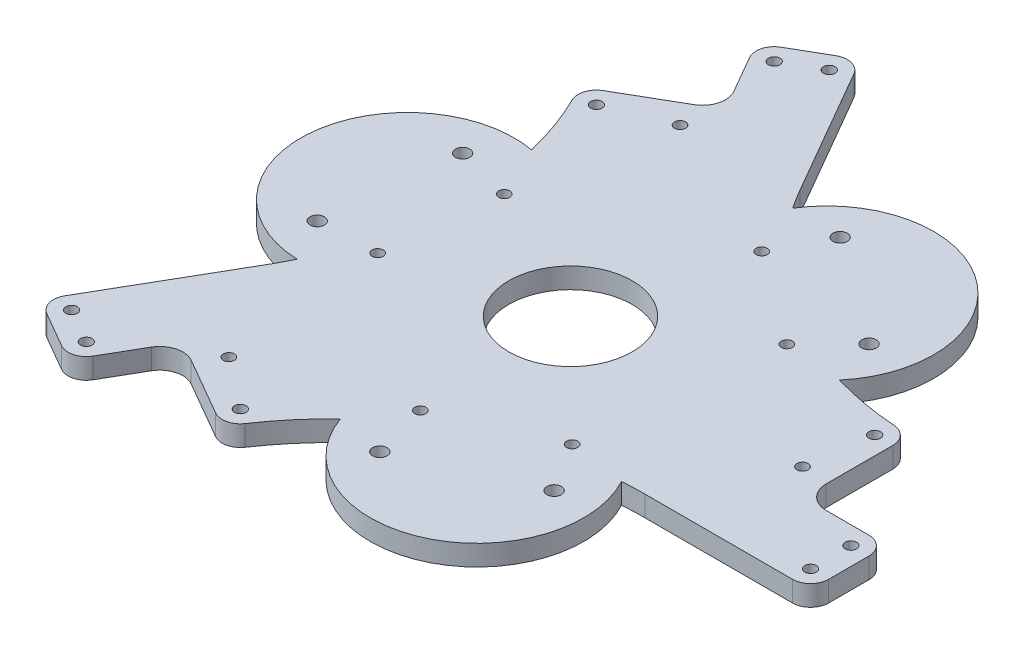
from build123d import *

# Parameters (mm, degrees)
SKETCH1_R                   = 41
BOSS_EXTRUDE1_DEPTH         = 50
FILLET2_R                   = 2
SKETCH3_R                   = 8.75
LOVIT_D17_5_THRU_DEPTH      = 623.015124039
SKETCH4_R                   = 12
LOBAC_D24X5_DEPTH           = 5
SKETCH5_R                   = 7
LOCHOT_D14_THRU_DEPTH       = 623.015124039
PATTERN_LOVIT_X3_COUNT      = 3
SKETCH6_R                   = 10
LOBAC_D20X5_DEPTH           = 5
PATTERN_LOBAC14_X3_COUNT    = 3
BOSS_EXTRUDE2_DEPTH         = 225
MATTREOVAU_D25_START        = -175
MATTREOVAU_D25_DEPTH        = 25
MATTREOVAU_GUSSET6_START    = -175
MATTREOVAU_GUSSET6_DEPTH    = 25
MATTREOVAU_GUSSET6_2_DEPTH  = 25
MATTREOVAU_GUSSET6_3_DEPTH  = 25
MATTREOVAU_GUSSET6_4_DEPTH  = 25
MATTREOVAU_GUSSET6_5_DEPTH  = 25
MATTREOTRON_X2_START        = -175
SKETCH10_R                  = 129.92
MATTREOTRON_X2_DEPTH        = 25
MATTREOTRON_X2_2_DEPTH      = 25
SK_TOOLCATKHUNG_W           = 940
SK_TOOLCATKHUNG_H           = 940
TOOL_CATCHANKHUNG_DEPTH     = 50
LOBAT_M16_X9_START          = -175
SK_LOVAU9_R                 = 7
LOBAT_M16_X9_DEPTH          = 25
LOGIUA_D150_START           = -175
SK_LOGIUA_R                 = 75
LOGIUA_D150_DEPTH           = 25
LOVIT_M20_X6_START          = -175
SKETCH12_R                  = 8.75
LOVIT_M20_X6_DEPTH          = 25
PADVIT_M12_X6_START         = -150
PADVIT_M12_X6_DEPTH         = 25
PADVIT_M12_X6_2_DEPTH       = 25
PADVIT_M12_X6_3_DEPTH       = 25
PADVIT_M12_X6_4_DEPTH       = 25
PADVIT_M12_X6_5_DEPTH       = 25
PADVIT_M12_X6_6_DEPTH       = 25
LOBU_M12_THRU_X6_START      = -175
SK_LOBU_M12_R               = 6.75
LOBU_M12_THRU_X6_DEPTH      = 25
LOBU_M12_CBORE_X6_START     = -187
SK_CBORE_M12_R              = 10
LOBU_M12_CBORE_X6_DEPTH     = 13
LOREN_M12_PAD_X6_START      = -175
SK_REN_M12_R                = 5.1
LOREN_M12_PAD_X6_DEPTH      = 20
BOSS_PADGOC_X3_START        = -175
SKETCH13_R                  = 32
BOSS_PADGOC_X3_DEPTH        = 25
BOSS_PADGOC_X3_2_DEPTH      = 25
BOSS_PADGOC_X3_3_DEPTH      = 25
LOBU_M12_THRU_GOC_X3_START  = -175
SKETCH14_R                  = 6.75
LOBU_M12_THRU_GOC_X3_DEPTH  = 12
LOBU_M12_CBORE_GOC_X3_START = -187
SKETCH15_R                  = 10
LOBU_M12_CBORE_GOC_X3_DEPTH = 13
LOREN_M12_GOC_X3_START      = -175
SKETCH16_R                  = 5.1
LOREN_M12_GOC_X3_DEPTH      = 20


with BuildPart() as part:
    # Sketch1 → Boss-Extrude1 (new body)
    with BuildSketch(Plane(origin=(0, 0, 0), x_dir=(1, 0, 0), z_dir=(0, 1, 0))):
        with BuildLine():
            Line((8.371578903, 273.5), (-81.292341855, 428.802466359))
            ThreePointArc((-81.292341855, 428.802466359), (-95.865294463, 439.98468619), (-114.076951546, 437.58707605))
            Line((-114.076951546, 437.58707605), (-156.512196331, 413.08707605))
            ThreePointArc((-156.512196331, 413.08707605), (-167.694416162, 398.514123442), (-165.296806022, 380.302466359))
            Line((-165.296806022, 380.302466359), (-139.296806022, 335.269145362))
            ThreePointArc((-139.296806022, 335.269145362), (-136.699395037, 315.53985019), (-148.813466521, 299.752484864))
            Line((-148.813466521, 299.752484864), (-218.954486267, 259.256548232))
            ThreePointArc((-218.954486267, 259.256548232), (-229.90514131, 245.491014911), (-228.527519154, 227.955082924))
            ThreePointArc((-228.527519154, 227.955082924), (-190.232761583, 47.667531746), (-241.043737387, -129.5))
            Line((-241.043737387, -129.5), (-330.707658145, -284.802466359))
            ThreePointArc((-330.707658145, -284.802466359), (-333.105268285, -303.014123442), (-321.923048454, -317.58707605))
            Line((-321.923048454, -317.58707605), (-279.487803669, -342.08707605))
            ThreePointArc((-279.487803669, -342.08707605), (-261.276146586, -344.48468619), (-246.703193978, -333.302466359))
            Line((-246.703193978, -333.302466359), (-220.703193978, -288.269145362))
            ThreePointArc((-220.703193978, -288.269145362), (-204.915828652, -276.155073879), (-185.186533479, -278.752484864))
            Line((-185.186533479, -278.752484864), (-115.045513733, -319.248421496))
            ThreePointArc((-115.045513733, -319.248421496), (-97.648884659, -321.849200291), (-83.151133157, -311.888178513))
            ThreePointArc((-83.151133157, -311.888178513), (53.835087364, -188.580170036), (232.672158483, -144))
            Line((232.672158483, -144), (412, -144))
            ThreePointArc((412, -144), (428.970562748, -136.970562748), (436, -120))
            Line((436, -120), (436, -71))
            ThreePointArc((436, -71), (428.970562748, -54.029437252), (412, -47))
            Line((412, -47), (360, -47))
            ThreePointArc((360, -47), (341.615223689, -39.384776311), (334, -21))
            Line((334, -21), (334, 59.991873264))
            ThreePointArc((334, 59.991873264), (327.554025969, 76.35818538), (311.678652311, 83.933095589))
            ThreePointArc((311.678652311, 83.933095589), (136.397674219, 140.91263829), (8.371578903, 273.5))
        make_face()
        with Locations(Location((0, 0, 0), (0, 0, 270))):
            Circle(SKETCH1_R, mode=Mode.SUBTRACT)
    extrude(amount=BOSS_EXTRUDE1_DEPTH)

    # Fillet2
    fillet2_edges = [part.edges().sort_by_distance(p)[0] for p in [
        (341.615223689, 50, 39.384776311),
        (334, 50, -19.495936632),
        (327.554025969, 50, -76.35818538),
        (-95.865294463, 50, -439.98468619),
        (-135.294573939, 50, -425.33707605),
        (-167.694416162, 50, -398.514123442),
        (-152.296806022, 50, -357.785805861),
        (327.554025969, 0, -76.35818538),
        (334, 0, -19.495936632),
        (341.615223689, 0, 39.384776311),
        (386, 0, 47),
        (428.970562748, 0, 54.029437252),
        (436, 0, 95.5),
        (428.970562748, 0, 136.970562748),
        (322.336079242, 0, 144),
        (53.835087364, 0, 188.580170036),
        (-136.699395037, 50, -315.53985019),
        (-97.648884659, 0, 321.849200291),
        (-150.116023606, 0, 299.00045318),
        (-204.915828652, 0, 276.155073879),
        (-233.703193978, 0, 310.785805861),
        (-261.276146586, 0, 344.48468619),
        (-300.705426061, 0, 329.83707605),
        (-333.105268285, 0, 303.014123442),
        (-285.875697766, 0, 207.15123318),
        (-190.232761583, 0, -47.667531746),
        (-229.90514131, 0, -245.491014911),
        (-183.883976394, 50, -279.504516548),
        (-183.883976394, 0, -279.504516548),
        (-136.699395037, 0, -315.53985019),
        (-152.296806022, 0, -357.785805861),
        (-167.694416162, 0, -398.514123442),
        (-135.294573939, 0, -425.33707605),
        (-95.865294463, 0, -439.98468619),
        (-36.460381476, 0, -351.15123318),
        (136.397674219, 0, -140.91263829),
        (-229.90514131, 50, -245.491014911),
        (-190.232761583, 50, -47.667531746),
        (-285.875697766, 50, 207.15123318),
        (-333.105268285, 50, 303.014123442),
        (136.397674219, 50, -140.91263829),
        (-300.705426061, 50, 329.83707605),
        (-261.276146586, 50, 344.48468619),
        (-233.703193978, 50, 310.785805861),
        (-204.915828652, 50, 276.155073879),
        (-150.116023606, 50, 299.00045318),
        (-97.648884659, 50, 321.849200291),
        (53.835087364, 50, 188.580170036),
        (322.336079242, 50, 144),
        (428.970562748, 50, 136.970562748),
        (436, 50, 95.5),
        (-36.460381476, 50, -351.15123318),
        (428.970562748, 50, 54.029437252),
        (386, 50, 47),
    ]]
    fillet(fillet2_edges, radius=FILLET2_R)

    # Sketch3 → LoVit-D17.5-Thru (cut, symmetric)
    with BuildSketch(Plane(origin=(0, 0, 0), x_dir=(1, 0, 0), z_dir=(0, 1, 0))):
        with Locations(Location((223, -77, 0), (0, 0, 270))):
            Circle(SKETCH3_R)
        with Locations(Location((412, -77, 0), (0, 0, 270))):
            Circle(SKETCH3_R)
        with Locations(Location((303, 25.5, 0), (0, 0, 270))):
            Circle(SKETCH3_R)
        with Locations(Location((223, 25.5, 0), (0, 0, 270))):
            Circle(SKETCH3_R)
    lovit_d17_5_thru = extrude(amount=LOVIT_D17_5_THRU_DEPTH, both=True, mode=Mode.SUBTRACT)

    # Sketch4 → LoBac-D24x5 (cut)
    with BuildSketch(Plane(origin=(0, 0, 0), x_dir=(1, 0, 0), z_dir=(0, 1, 0))):
        with Locations(Location((223, -77, 0), (0, 0, 270))):
            Circle(SKETCH4_R)
        with Locations(Location((412, -77, 0), (0, 0, 270))):
            Circle(SKETCH4_R)
        with Locations(Location((303, 25.5, 0), (0, 0, 270))):
            Circle(SKETCH4_R)
        with Locations(Location((223, 25.5, 0), (0, 0, 270))):
            Circle(SKETCH4_R)
    lobac_d24x5 = extrude(amount=LOBAC_D24X5_DEPTH, mode=Mode.SUBTRACT)

    # Sketch5 → LoChot-D14-Thru (cut, symmetric)
    with BuildSketch(Plane(origin=(0, 0, 0), x_dir=(1, 0, 0), z_dir=(0, 1, 0))):
        with Locations(Location((305, -77, 0), (0, 0, 270))):
            Circle(SKETCH5_R)
        with Locations(Location((330, -77, 0), (0, 0, 270))):
            Circle(SKETCH5_R)
    lochot_d14_thru = extrude(amount=LOCHOT_D14_THRU_DEPTH, both=True, mode=Mode.SUBTRACT)

    # Pattern-LoVit-x3: LoVit-D17.5-Thru, LoBac-D24x5, LoChot-D14-Thru ×3 about axis
    pattern_lovit_x3_axis = Axis((0, 0, 0), (0, 1, 0))
    add([lovit_d17_5_thru.rotate(pattern_lovit_x3_axis, i * 360 / PATTERN_LOVIT_X3_COUNT) for i in range(1, PATTERN_LOVIT_X3_COUNT)], mode=Mode.SUBTRACT)
    add([lobac_d24x5.rotate(pattern_lovit_x3_axis, i * 360 / PATTERN_LOVIT_X3_COUNT) for i in range(1, PATTERN_LOVIT_X3_COUNT)], mode=Mode.SUBTRACT)
    add([lochot_d14_thru.rotate(pattern_lovit_x3_axis, i * 360 / PATTERN_LOVIT_X3_COUNT) for i in range(1, PATTERN_LOVIT_X3_COUNT)], mode=Mode.SUBTRACT)

    # Sketch6 → LoBac-D20x5 (cut)
    with BuildSketch(Plane(origin=(0, 0, 0), x_dir=(1, 0, 0), z_dir=(0, 1, 0))):
        with Locations(Location((305, -77, 0), (0, 0, 270))):
            Circle(SKETCH6_R)
        with Locations(Location((330, -77, 0), (0, 0, 270))):
            Circle(SKETCH6_R)
    lobac_d20x5 = extrude(amount=LOBAC_D20X5_DEPTH, mode=Mode.SUBTRACT)

    # Pattern-LoBac14-x3: LoBac-D20x5 ×3 about axis
    pattern_lobac14_x3_axis = Axis((0, 0, 0), (0, 1, 0))
    for i in range(1, PATTERN_LOBAC14_X3_COUNT):
        add(lobac_d20x5.rotate(pattern_lobac14_x3_axis, i * 360 / PATTERN_LOBAC14_X3_COUNT), mode=Mode.SUBTRACT)


with BuildPart() as body_2:
    # Sketch7 → Boss-Extrude2 (new body)
    with BuildSketch(Plane(origin=(0, 50, 0), x_dir=(1, 0, 0), z_dir=(0, 1, 0))):
        with BuildLine():
            Line((-184.186533479, -277.020434056), (-114.045513733, -317.516370688))
            ThreePointArc((-114.045513733, -317.516370688), (-98.098603748, -319.900417917), (-84.808998205, -310.769481287))
            ThreePointArc((-84.808998205, -310.769481287), (52.896310087, -186.814186676), (232.672158483, -142))
            Line((232.672158483, -142), (412, -142))
            ThreePointArc((412, -142), (427.556349186, -135.556349186), (434, -120))
            Line((434, -120), (434, -71))
            ThreePointArc((434, -71), (427.556349186, -55.443650814), (412, -49))
            Line((412, -49), (360, -49))
            ThreePointArc((360, -49), (340.201010127, -40.798989873), (332, -21))
            Line((332, -21), (332, 59.991873264))
            ThreePointArc((332, 59.991873264), (326.091190472, 74.994326037), (311.538764618, 81.937993729))
            ThreePointArc((311.538764618, 81.937993729), (135.337676405, 139.21664164), (6.639528096, 272.5))
            Line((6.639528096, 272.5), (-83.024392663, 427.802466359))
            ThreePointArc((-83.024392663, 427.802466359), (-96.382932554, 438.052834538), (-113.076951546, 435.855025242))
            Line((-113.076951546, 435.855025242), (-155.512196331, 411.355025242))
            ThreePointArc((-155.512196331, 411.355025242), (-165.76256451, 397.996485351), (-163.564755215, 381.302466359))
            Line((-163.564755215, 381.302466359), (-137.564755215, 336.269145362))
            ThreePointArc((-137.564755215, 336.269145362), (-134.767543384, 315.0222121), (-147.813466521, 298.020434056))
            Line((-147.813466521, 298.020434056), (-217.954486267, 257.524497424))
            ThreePointArc((-217.954486267, 257.524497424), (-227.992586724, 244.90609188), (-226.729766413, 228.831487559))
            ThreePointArc((-226.729766413, 228.831487559), (-188.233986493, 47.597545036), (-239.311686579, -130.5))
            Line((-239.311686579, -130.5), (-328.975607337, -285.802466359))
            ThreePointArc((-328.975607337, -285.802466359), (-331.173416632, -302.496485351), (-320.923048454, -315.855025242))
            Line((-320.923048454, -315.855025242), (-278.487803669, -340.355025242))
            ThreePointArc((-278.487803669, -340.355025242), (-261.793784676, -342.552834538), (-248.435244785, -332.302466359))
            Line((-248.435244785, -332.302466359), (-222.435244785, -287.269145362))
            ThreePointArc((-222.435244785, -287.269145362), (-205.433466742, -274.223222226), (-184.186533479, -277.020434056))
        make_face()
        with BuildLine():
            Line((-180.186533479, -270.092230826), (-110.045513733, -310.588167458))
            ThreePointArc((-110.045513733, -310.588167458), (-99.897480106, -312.105288422), (-91.440458397, -306.294692385))
            ThreePointArc((-91.440458397, -306.294692385), (49.141200982, -179.750253239), (232.672158483, -134))
            Line((232.672158483, -134), (412, -134))
            ThreePointArc((412, -134), (421.899494937, -129.899494937), (426, -120))
            Line((426, -120), (426, -71))
            ThreePointArc((426, -71), (421.899494937, -61.100505063), (412, -57))
            Line((412, -57), (360, -57))
            ThreePointArc((360, -57), (334.544155877, -46.455844123), (324, -21))
            Line((324, -21), (324, 59.991873264))
            ThreePointArc((324, 59.991873264), (320.239848482, 69.538888665), (310.979213848, 73.957586287))
            ThreePointArc((310.979213848, 73.957586287), (131.09768515, 132.432655043), (-0.288675135, 268.5))
            Line((-0.288675135, 268.5), (-89.952595893, 423.802466359))
            ThreePointArc((-89.952595893, 423.802466359), (-98.453484914, 430.325427927), (-109.076951546, 428.926822012))
            Line((-109.076951546, 428.926822012), (-151.512196331, 404.426822012))
            ThreePointArc((-151.512196331, 404.426822012), (-158.035157899, 395.925932991), (-156.636551984, 385.302466359))
            Line((-156.636551984, 385.302466359), (-130.636551984, 340.269145362))
            ThreePointArc((-130.636551984, 340.269145362), (-127.040136774, 312.951659739), (-143.813466521, 291.092230826))
            Line((-143.813466521, 291.092230826), (-213.954486267, 250.596294194))
            ThreePointArc((-213.954486267, 250.596294194), (-220.342368376, 242.566399757), (-219.538755451, 232.337106098))
            ThreePointArc((-219.538755451, 232.337106098), (-180.238886133, 47.317598196), (-232.383483349, -134.5))
            Line((-232.383483349, -134.5), (-322.047404107, -289.802466359))
            ThreePointArc((-322.047404107, -289.802466359), (-323.446010022, -300.425932991), (-316.923048454, -308.926822012))
            Line((-316.923048454, -308.926822012), (-274.487803669, -333.426822012))
            ThreePointArc((-274.487803669, -333.426822012), (-263.864337037, -334.825427927), (-255.363448016, -328.302466359))
            Line((-255.363448016, -328.302466359), (-229.363448016, -283.269145362))
            ThreePointArc((-229.363448016, -283.269145362), (-207.504019103, -266.495815616), (-180.186533479, -270.092230826))
        make_face(mode=Mode.SUBTRACT)
    extrude(amount=-BOSS_EXTRUDE2_DEPTH)


with BuildPart() as body_3:
    # Sk-MatTreoVau → MatTreoVau-D25 (new body)
    with BuildSketch(Plane(origin=(0, 0, 0), x_dir=(1, 0, 0), z_dir=(0, 1, 0)).offset(MATTREOVAU_D25_START)):
        with BuildLine():
            Line((-114.045513733, -317.516370688), (-184.186533479, -277.020434056))
            ThreePointArc((-184.186533479, -277.020434056), (-205.433466742, -274.223222226), (-222.435244785, -287.269145362))
            Line((-222.435244785, -287.269145362), (-248.435244785, -332.302466359))
            ThreePointArc((-248.435244785, -332.302466359), (-261.793784676, -342.552834538), (-278.487803669, -340.355025242))
            Line((-278.487803669, -340.355025242), (-320.923048454, -315.855025242))
            ThreePointArc((-320.923048454, -315.855025242), (-331.173416632, -302.496485351), (-328.975607337, -285.802466359))
            Line((-328.975607337, -285.802466359), (-239.311686579, -130.5))
            ThreePointArc((-239.311686579, -130.5), (-218.0908365, -87.810397331), (-202.337273797, -42.815376315))
            ThreePointArc((-202.337273797, -42.815376315), (-206.139748433, -21.394031931), (-225.28696343, -11.0636415))
            ThreePointArc((-225.28696343, -11.0636415), (-258.528834053, 27.619593831), (-217.865133416, 58.407222981))
            ThreePointArc((-217.865133416, 58.407222981), (-196.967697859, 64.459494929), (-188.725649398, 84.594078256))
            ThreePointArc((-188.725649398, 84.594078256), (-200.638746521, 158.580604294), (-226.729766413, 228.831487559))
            ThreePointArc((-226.729766413, 228.831487559), (-227.992586724, 244.90609188), (-217.954486267, 257.524497424))
            Line((-217.954486267, 257.524497424), (-147.813466521, 298.020434056))
            ThreePointArc((-147.813466521, 298.020434056), (-134.767543384, 315.0222121), (-137.564755215, 336.269145362))
            Line((-137.564755215, 336.269145362), (-163.564755215, 381.302466359))
            ThreePointArc((-163.564755215, 381.302466359), (-165.76256451, 397.996485351), (-155.512196331, 411.355025242))
            Line((-155.512196331, 411.355025242), (-113.076951546, 435.855025242))
            ThreePointArc((-113.076951546, 435.855025242), (-96.382932554, 438.052834538), (-83.024392663, 427.802466359))
            Line((-83.024392663, 427.802466359), (6.639528096, 272.5))
            ThreePointArc((6.639528096, 272.5), (32.999383444, 232.777403407), (64.089433337, 196.636907398))
            ThreePointArc((64.089433337, 196.636907398), (84.542099075, 189.219274839), (103.062087117, 200.636054222))
            ThreePointArc((103.062087117, 200.636054222), (153.183686926, 210.082740985), (159.514705574, 159.473128647))
            ThreePointArc((159.514705574, 159.473128647), (154.307409053, 138.349282607), (167.623445478, 121.144167596))
            ThreePointArc((167.623445478, 121.144167596), (237.654205127, 94.467949324), (311.538764618, 81.937993729))
            ThreePointArc((311.538764618, 81.937993729), (326.091190472, 74.994326037), (332, 59.991873264))
            Line((332, 59.991873264), (332, -21))
            ThreePointArc((332, -21), (340.201010127, -40.798989873), (360, -49))
            Line((360, -49), (412, -49))
            ThreePointArc((412, -49), (427.556349186, -55.443650814), (434, -71))
            Line((434, -71), (434, -120))
            ThreePointArc((434, -120), (427.556349186, -135.556349186), (412, -142))
            Line((412, -142), (232.672158483, -142))
            ThreePointArc((232.672158483, -142), (185.091453055, -144.967006076), (138.24784046, -153.821531083))
            ThreePointArc((138.24784046, -153.821531083), (121.597649359, -167.825242907), (122.224876312, -189.572412722))
            ThreePointArc((122.224876312, -189.572412722), (105.345147127, -237.702334816), (58.350427842, -217.880351628))
            ThreePointArc((58.350427842, -217.880351628), (42.660288806, -202.808777536), (21.10220392, -205.738245852))
            ThreePointArc((21.10220392, -205.738245852), (-37.015458606, -253.048553618), (-84.808998205, -310.769481287))
            ThreePointArc((-84.808998205, -310.769481287), (-98.098603748, -319.900417917), (-114.045513733, -317.516370688))
        make_face()
    extrude(amount=-MATTREOVAU_D25_DEPTH)


with BuildPart() as body_4:
    # Sketch8 → MatTreoVau-Gusset6 (new body)
    with BuildSketch(Plane(origin=(0, 0, 0), x_dir=(1, 0, 0), z_dir=(0, 1, 0)).offset(MATTREOVAU_GUSSET6_START)):
        Polygon((-137.497159422, -74.963532139), (-156.055536108, 13.10227652), (-294.846276167, -31.474965139), (-282.474025043, -90.185504245), align=None)
    extrude(amount=-MATTREOVAU_GUSSET6_DEPTH)


with BuildPart() as body_5:
    # Sketch8 → MatTreoVau-Gusset6 2 (new body)
    with BuildSketch(Plane(origin=(0, 0, 0), x_dir=(1, 0, 0), z_dir=(0, 1, 0)).offset(MATTREOVAU_GUSSET6_START)):
        Polygon((-155.299997302, 20.172031082), (-118.550255868, 102.327107033), (-257.036168472, 147.842511129), (-281.535996095, 93.072460496), align=None)
    extrude(amount=-MATTREOVAU_GUSSET6_2_DEPTH)


with BuildPart() as body_6:
    # Sketch8 → MatTreoVau-Gusset6 3 (new body)
    with BuildSketch(Plane(origin=(0, 0, 0), x_dir=(1, 0, 0), z_dir=(0, 1, 0)).offset(MATTREOVAU_GUSSET6_START)):
        Polygon((3.828256521, 156.557799078), (89.374672368, 128.596920411), (120.16501869, 271.081847941), (63.134074792, 289.722433719), align=None)
    extrude(amount=-MATTREOVAU_GUSSET6_3_DEPTH)


with BuildPart() as body_7:
    # Sketch8 → MatTreoVau-Gusset6 4 (new body)
    with BuildSketch(Plane(origin=(0, 0, 0), x_dir=(1, 0, 0), z_dir=(0, 1, 0)).offset(MATTREOVAU_GUSSET6_START)):
        Polygon((95.119490014, 124.40772733), (147.89300212, 51.50397969), (256.553454634, 148.678596024), (221.371113229, 197.28109445), align=None)
    extrude(amount=-MATTREOVAU_GUSSET6_4_DEPTH)


with BuildPart() as body_8:
    # Sketch8 → MatTreoVau-Gusset6 5 (new body)
    with BuildSketch(Plane(origin=(0, 0, 0), x_dir=(1, 0, 0), z_dir=(0, 1, 0)).offset(MATTREOVAU_GUSSET6_START)):
        with BuildLine():
            Line((-29.342746252, -153.831086723), (133.668902901, -81.594266938))
            ThreePointArc((133.668902901, -81.594266938), (143.083176972, -322.885541111), (-29.342746252, -153.831086723))
        make_face()
    extrude(amount=-MATTREOVAU_GUSSET6_5_DEPTH)


with BuildPart() as body_9:
    # Sketch10 → MatTreoTron-x2 (new body)
    with BuildSketch(Plane(origin=(0, 0, 0), x_dir=(1, 0, 0), z_dir=(0, 1, 0)).offset(MATTREOTRON_X2_START)):
        with Locations(Location((131.555784912, 180.338696502, 0), (0, 0, 270))):
            Circle(SKETCH10_R)
    extrude(amount=-MATTREOTRON_X2_DEPTH)


with BuildPart() as body_10:
    # Sketch10 → MatTreoTron-x2 2 (new body)
    with BuildSketch(Plane(origin=(0, 0, 0), x_dir=(1, 0, 0), z_dir=(0, 1, 0)).offset(MATTREOTRON_X2_START)):
        with Locations(Location((-221.955784912, 23.761303498, 0), (0, 0, 270))):
            Circle(SKETCH10_R)
    extrude(amount=-MATTREOTRON_X2_2_DEPTH)


with BuildPart() as body_3_1:
    add(body_3.part)

    # GopKhoi-MatTreo: union body 8, body 10, body 5, body 6, body 4, body 9, body 7
    add(body_8.part)
    add(body_10.part)
    add(body_5.part)
    add(body_6.part)
    add(body_4.part)
    add(body_9.part)
    add(body_7.part)

    # Sk-LoVau9 → LoBat-M16-x9 (cut)
    with BuildSketch(Plane(origin=(0, 0, 0), x_dir=(1, 0, 0), z_dir=(0, 1, 0)).offset(LOBAT_M16_X9_START)):
        with Locations(Location((412, -71, 0), (0, 0, 270))):
            Circle(SK_LOVAU9_R)
        with Locations(Location((412, -120, 0), (0, 0, 270))):
            Circle(SK_LOVAU9_R)
        with Locations(Location((-102.077, 416.802, 0), (0, 0, 270))):
            Circle(SK_LOVAU9_R)
        with Locations(Location((-144.512, 392.302, 0), (0, 0, 270))):
            Circle(SK_LOVAU9_R)
        with Locations(Location((-267.488, -321.302, 0), (0, 0, 270))):
            Circle(SK_LOVAU9_R)
        with Locations(Location((-309.923, -296.802, 0), (0, 0, 270))):
            Circle(SK_LOVAU9_R)
        with Locations(Location((-206.954, 238.472, 0), (0, 0, 270))):
            Circle(SK_LOVAU9_R)
        with Locations(Location((310, 59.992, 0), (0, 0, 270))):
            Circle(SK_LOVAU9_R)
        with Locations(Location((-103.046, -298.464, 0), (0, 0, 270))):
            Circle(SK_LOVAU9_R)
    extrude(amount=-LOBAT_M16_X9_DEPTH, mode=Mode.SUBTRACT)

    # Sk-LoGiua → LoGiua-D150 (cut)
    with BuildSketch(Plane(origin=(0, 0, 0), x_dir=(1, 0, 0), z_dir=(0, 1, 0)).offset(LOGIUA_D150_START)):
        with Locations(Location((0, 0, 0), (0, 0, 270))):
            Circle(SK_LOGIUA_R)
    extrude(amount=-LOGIUA_D150_DEPTH, mode=Mode.SUBTRACT)

    # Sketch12 → LoVit-M20-x6 (cut)
    with BuildSketch(Plane(origin=(0, 0, 0), x_dir=(1, 0, 0), z_dir=(0, 1, 0)).offset(LOVIT_M20_X6_START)):
        with Locations(Location((173.636464422, -193.52100202, 0), (0, 0, 270))):
            Circle(SKETCH12_R)
        with Locations(Location((26.726059565, -258.62273245, 0), (0, 0, 270))):
            Circle(SKETCH12_R)
        with Locations(Location((80.775871704, 247.134090223, 0), (0, 0, 270))):
            Circle(SKETCH12_R)
        with Locations(Location((210.610826516, 152.456812751, 0), (0, 0, 270))):
            Circle(SKETCH12_R)
        with Locations(Location((-254.412336126, -53.613088203, 0), (0, 0, 270))):
            Circle(SKETCH12_R)
        with Locations(Location((-237.336886081, 106.165919699, 0), (0, 0, 270))):
            Circle(SKETCH12_R)
    extrude(amount=-LOVIT_M20_X6_DEPTH, mode=Mode.SUBTRACT)

    # Sk-LoBu-M12 → LoBu-M12-Thru-x6 (cut)
    with BuildSketch(Plane(origin=(0, 0, 0), x_dir=(1, 0, 0), z_dir=(0, 1, 0)).offset(LOBU_M12_THRU_X6_START)):
        with Locations(Location((7.886992904, -190.512930413, 0), (0, 0, 270))):
            Circle(SK_LOBU_M12_R)
        with Locations(Location((135.844382435, -133.804652657, 0), (0, 0, 270))):
            Circle(SK_LOBU_M12_R)
        with Locations(Location((161.04705128, 102.088745556, 0), (0, 0, 270))):
            Circle(SK_LOBU_M12_R)
        with Locations(Location((47.957582181, 184.54900435, 0), (0, 0, 270))):
            Circle(SK_LOBU_M12_R)
        with Locations(Location((-168.934294158, 88.425684784, 0), (0, 0, 270))):
            Circle(SK_LOBU_M12_R)
        with Locations(Location((-183.801686509, -50.742856727, 0), (0, 0, 270))):
            Circle(SK_LOBU_M12_R)
    extrude(amount=-LOBU_M12_THRU_X6_DEPTH, mode=Mode.SUBTRACT)

    # Sk-CBore-M12 → LoBu-M12-CBore-x6 (cut)
    with BuildSketch(Plane(origin=(0, 0, 0), x_dir=(1, 0, 0), z_dir=(0, 1, 0)).offset(LOBU_M12_CBORE_X6_START)):
        with Locations(Location((7.886992904, -190.512930413, 0), (0, 0, 270))):
            Circle(SK_CBORE_M12_R)
        with Locations(Location((135.844382435, -133.804652657, 0), (0, 0, 270))):
            Circle(SK_CBORE_M12_R)
        with Locations(Location((161.04705128, 102.088745556, 0), (0, 0, 270))):
            Circle(SK_CBORE_M12_R)
        with Locations(Location((47.957582181, 184.54900435, 0), (0, 0, 270))):
            Circle(SK_CBORE_M12_R)
        with Locations(Location((-168.934294158, 88.425684784, 0), (0, 0, 270))):
            Circle(SK_CBORE_M12_R)
        with Locations(Location((-183.801686509, -50.742856727, 0), (0, 0, 270))):
            Circle(SK_CBORE_M12_R)
    extrude(amount=-LOBU_M12_CBORE_X6_DEPTH, mode=Mode.SUBTRACT)

    # Sketch14 → LoBu-M12-Thru-Goc-x3 (cut)
    with BuildSketch(Plane(origin=(0, 0, 0), x_dir=(1, 0, 0), z_dir=(0, 1, 0)).offset(LOBU_M12_THRU_GOC_X3_START)):
        with Locations(Location((299.502544984, -17.269208088, 0), (0, 0, 270))):
            Circle(SKETCH14_R)
        with Locations(Location((-164.706845399, -250.74220841, 0), (0, 0, 270))):
            Circle(SKETCH14_R)
        with Locations(Location((-134.795699585, 268.011416498, 0), (0, 0, 270))):
            Circle(SKETCH14_R)
    extrude(amount=-LOBU_M12_THRU_GOC_X3_DEPTH, mode=Mode.SUBTRACT)

    # Sketch15 → LoBu-M12-CBore-Goc-x3 (cut)
    with BuildSketch(Plane(origin=(0, 0, 0), x_dir=(1, 0, 0), z_dir=(0, 1, 0)).offset(LOBU_M12_CBORE_GOC_X3_START)):
        with Locations(Location((299.502544984, -17.269208088, 0), (0, 0, 270))):
            Circle(SKETCH15_R)
        with Locations(Location((-164.706845399, -250.74220841, 0), (0, 0, 270))):
            Circle(SKETCH15_R)
        with Locations(Location((-134.795699585, 268.011416498, 0), (0, 0, 270))):
            Circle(SKETCH15_R)
    extrude(amount=-LOBU_M12_CBORE_GOC_X3_DEPTH, mode=Mode.SUBTRACT)


with BuildPart() as body_4_2:
    # Sk-ToolCatKhung → Tool-CatChanKhung (new body)
    with BuildSketch(Plane(origin=(0, 0, 0), x_dir=(1, 0, 0), z_dir=(0, 1, 0))):
        Rectangle(SK_TOOLCATKHUNG_W, SK_TOOLCATKHUNG_H)
    extrude(amount=TOOL_CATCHANKHUNG_DEPTH)


with BuildPart() as body_2_1:
    add(body_2.part)

    # CatChanKhung: cut body 4 2
    add(body_4_2.part, mode=Mode.SUBTRACT)


with BuildPart() as body_4_3:
    # Sk-PadVit-M12 → PadVit-M12-x6 (new body)
    with BuildSketch(Plane(origin=(0, 0, 0), x_dir=(1, 0, 0), z_dir=(0, 1, 0)).offset(PADVIT_M12_X6_START)):
        with BuildLine():
            Line((33.404320909, -192.077803179), (19.024323449, -168.052490006))
            ThreePointArc((19.024323449, -168.052490006), (0.635928159, -179.723024942), (-17.116477868, -192.339940068))
            Line((-17.116477868, -192.339940068), (-0.303926473, -214.730521025))
            ThreePointArc((-0.303926473, -214.730521025), (16.253606071, -202.962821341), (33.404320909, -192.077803179))
        make_face()
    extrude(amount=-PADVIT_M12_X6_DEPTH)


with BuildPart() as body_5_2:
    # Sk-PadVit-M12 → PadVit-M12-x6 2 (new body)
    with BuildSketch(Plane(origin=(0, 0, 0), x_dir=(1, 0, 0), z_dir=(0, 1, 0)).offset(PADVIT_M12_X6_START)):
        with BuildLine():
            Line((119.864532126, -153.760284428), (111.723931352, -126.96978949))
            ThreePointArc((111.723931352, -126.96978949), (132.720975416, -121.185447904), (153.99197281, -116.507933936))
            Line((153.99197281, -116.507933936), (159.287609255, -144.002592229))
            ThreePointArc((159.287609255, -144.002592229), (139.44831361, -148.365273526), (119.864532126, -153.760284428))
        make_face()
    extrude(amount=-PADVIT_M12_X6_2_DEPTH)


with BuildPart() as body_6_2:
    # Sk-PadVit-M12 → PadVit-M12-x6 3 (new body)
    with BuildSketch(Plane(origin=(0, 0, 0), x_dir=(1, 0, 0), z_dir=(0, 1, 0)).offset(PADVIT_M12_X6_START)):
        with BuildLine():
            Line((149.643616505, 124.969841041), (136.027073366, 100.503747096))
            ThreePointArc((136.027073366, 100.503747096), (155.328246483, 90.414188961), (175.131014685, 81.348603567))
            Line((175.131014685, 81.348603567), (186.115561774, 107.103986019))
            ThreePointArc((186.115561774, 107.103986019), (167.6456722, 115.559387781), (149.643616505, 124.969841041))
        make_face()
    extrude(amount=-PADVIT_M12_X6_3_DEPTH)


with BuildPart() as body_7_2:
    # Sk-PadVit-M12 → PadVit-M12-x6 4 (new body)
    with BuildSketch(Plane(origin=(0, 0, 0), x_dir=(1, 0, 0), z_dir=(0, 1, 0)).offset(PADVIT_M12_X6_START)):
        with BuildLine():
            Line((73.229589768, 180.687853253), (54.098632328, 160.242646786))
            ThreePointArc((54.098632328, 160.242646786), (38.590729993, 175.534456103), (23.904392162, 191.616929425))
            Line((23.904392162, 191.616929425), (45.067654228, 209.950405329))
            ThreePointArc((45.067654228, 209.950405329), (58.765488551, 194.950406173), (73.229589768, 180.687853253))
        make_face()
    extrude(amount=-PADVIT_M12_X6_4_DEPTH)


with BuildPart() as body_8_2:
    # Sk-PadVit-M12 → PadVit-M12-x6 5 (new body)
    with BuildSketch(Plane(origin=(0, 0, 0), x_dir=(1, 0, 0), z_dir=(0, 1, 0)).offset(PADVIT_M12_X6_START)):
        with BuildLine():
            Line((-183.048102175, 67.109416853), (-155.051573466, 67.550302605))
            ThreePointArc((-155.051573466, 67.550302605), (-155.964432679, 89.310384293), (-158.014875534, 110.992869186))
            Line((-158.014875534, 110.992869186), (-185.811951219, 107.627964529))
            ThreePointArc((-185.811951219, 107.627964529), (-183.899518941, 87.404877658), (-183.048102175, 67.109416853))
        make_face()
    extrude(amount=-PADVIT_M12_X6_5_DEPTH)


with BuildPart() as body_9_2:
    # Sk-PadVit-M12 → PadVit-M12-x6 6 (new body)
    with BuildSketch(Plane(origin=(0, 0, 0), x_dir=(1, 0, 0), z_dir=(0, 1, 0)).offset(PADVIT_M12_X6_START)):
        with BuildLine():
            Line((-193.093929834, -26.926117461), (-165.82235776, -33.271301195))
            ThreePointArc((-165.82235776, -33.271301195), (-171.311418332, -54.347465008), (-177.895997523, -75.107469437))
            Line((-177.895997523, -75.107469437), (-204.354920767, -65.946389764))
            ThreePointArc((-204.354920767, -65.946389764), (-198.213534405, -46.583693325), (-193.093929834, -26.926117461))
        make_face()
    extrude(amount=-PADVIT_M12_X6_6_DEPTH)


with BuildPart() as body_2_2:
    add(body_2_1.part)

    # GopKhung-Pad: union body 8 2, body 9 2, body 5 2, body 6 2, body 4 3, body 7 2
    add(body_8_2.part)
    add(body_9_2.part)
    add(body_5_2.part)
    add(body_6_2.part)
    add(body_4_3.part)
    add(body_7_2.part)

    # Sk-Ren-M12 → LoRen-M12-Pad-x6 (cut)
    with BuildSketch(Plane(origin=(0, 0, 0), x_dir=(1, 0, 0), z_dir=(0, 1, 0)).offset(LOREN_M12_PAD_X6_START)):
        with Locations(Location((7.886992904, -190.512930413, 0), (0, 0, 270))):
            Circle(SK_REN_M12_R)
        with Locations(Location((135.844382435, -133.804652657, 0), (0, 0, 270))):
            Circle(SK_REN_M12_R)
        with Locations(Location((161.04705128, 102.088745556, 0), (0, 0, 270))):
            Circle(SK_REN_M12_R)
        with Locations(Location((47.957582181, 184.54900435, 0), (0, 0, 270))):
            Circle(SK_REN_M12_R)
        with Locations(Location((-168.934294158, 88.425684784, 0), (0, 0, 270))):
            Circle(SK_REN_M12_R)
        with Locations(Location((-183.801686509, -50.742856727, 0), (0, 0, 270))):
            Circle(SK_REN_M12_R)
    extrude(amount=LOREN_M12_PAD_X6_DEPTH, mode=Mode.SUBTRACT)


with BuildPart() as body_4_4:
    # Sketch13 → Boss-PadGoc-x3 (new body)
    with BuildSketch(Plane(origin=(0, 0, 0), x_dir=(1, 0, 0), z_dir=(0, 1, 0)).offset(BOSS_PADGOC_X3_START)):
        with Locations(Location((299.502544984, -17.269208088, 0), (0, 0, 270))):
            Circle(SKETCH13_R)
    extrude(amount=BOSS_PADGOC_X3_DEPTH)


with BuildPart() as body_5_3:
    # Sketch13 → Boss-PadGoc-x3 2 (new body)
    with BuildSketch(Plane(origin=(0, 0, 0), x_dir=(1, 0, 0), z_dir=(0, 1, 0)).offset(BOSS_PADGOC_X3_START)):
        with Locations(Location((-164.706845399, -250.74220841, 0), (0, 0, 270))):
            Circle(SKETCH13_R)
    extrude(amount=BOSS_PADGOC_X3_2_DEPTH)


with BuildPart() as body_6_3:
    # Sketch13 → Boss-PadGoc-x3 3 (new body)
    with BuildSketch(Plane(origin=(0, 0, 0), x_dir=(1, 0, 0), z_dir=(0, 1, 0)).offset(BOSS_PADGOC_X3_START)):
        with Locations(Location((-134.795699585, 268.011416498, 0), (0, 0, 270))):
            Circle(SKETCH13_R)
    extrude(amount=BOSS_PADGOC_X3_3_DEPTH)


with BuildPart() as body_2_3:
    add(body_2_2.part)

    # Khoi2-KhungHan: union body 6 3, body 4 4, body 5 3
    add(body_6_3.part)
    add(body_4_4.part)
    add(body_5_3.part)

    # Sketch16 → LoRen-M12-Goc-x3 (cut)
    with BuildSketch(Plane(origin=(0, 0, 0), x_dir=(1, 0, 0), z_dir=(0, 1, 0)).offset(LOREN_M12_GOC_X3_START)):
        with Locations(Location((299.502544984, -17.269208088, 0), (0, 0, 270))):
            Circle(SKETCH16_R)
        with Locations(Location((-164.706845399, -250.74220841, 0), (0, 0, 270))):
            Circle(SKETCH16_R)
        with Locations(Location((-134.795699585, 268.011416498, 0), (0, 0, 270))):
            Circle(SKETCH16_R)
    extrude(amount=LOREN_M12_GOC_X3_DEPTH, mode=Mode.SUBTRACT)


solid = body_3_1.part
